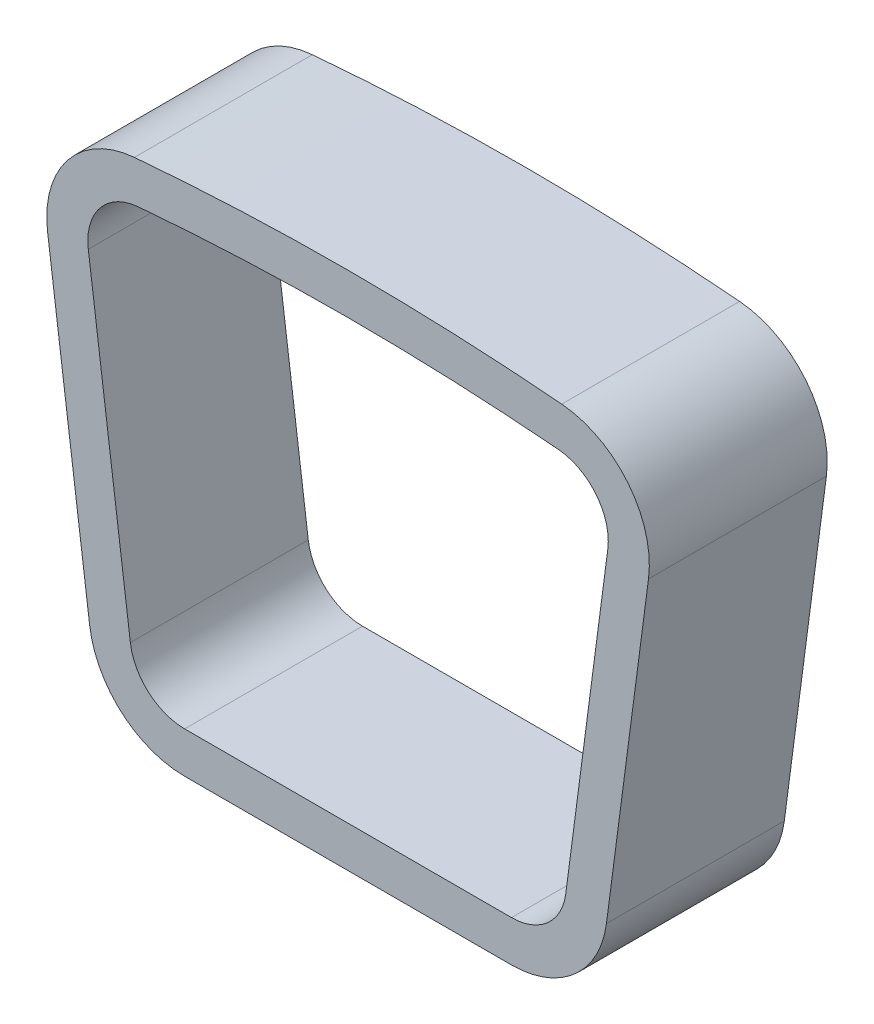
from build123d import *

# Parameters (mm, degrees)
BOSS_EXTRUDE1_DEPTH = 6.5


with BuildPart() as part:
    # Sketch1 → Boss-Extrude1 (new body)
    with BuildSketch(Plane.XY):
        with BuildLine():
            Line((9.441130989, 75.543158327), (10.978710332, 87.222232942))
            ThreePointArc((10.978710332, 87.222232942), (10.23623569, 89.872312951), (7.807292937, 91.166310537))
            ThreePointArc((7.807292937, 91.166310537), (0, 91.5), (-7.807292937, 91.166310537))
            ThreePointArc((-7.807292937, 91.166310537), (-10.23623569, 89.872312951), (-10.978710332, 87.222232942))
            Line((-10.978710332, 87.222232942), (-9.441130989, 75.543158327))
            ThreePointArc((-9.441130989, 75.543158327), (-8.278784327, 73.368560674), (-5.971073974, 72.5))
            Line((-5.971073974, 72.5), (5.971073974, 72.5))
            ThreePointArc((5.971073974, 72.5), (8.278784327, 73.368560674), (9.441130989, 75.543158327))
        make_face()
        with BuildLine():
            Line((-9.49154304, 87.418022231), (-7.953963697, 75.738947616))
            ThreePointArc((-7.953963697, 75.738947616), (-7.289765605, 74.496320385), (-5.971073974, 74))
            Line((-5.971073974, 74), (5.971073974, 74))
            ThreePointArc((5.971073974, 74), (7.289765605, 74.496320385), (7.953963697, 75.738947616))
            Line((7.953963697, 75.738947616), (9.49154304, 87.418022231))
            ThreePointArc((9.49154304, 87.418022231), (9.067271816, 88.932353664), (7.679304529, 89.671780856))
            ThreePointArc((7.679304529, 89.671780856), (0, 90), (-7.679304529, 89.671780856))
            ThreePointArc((-7.679304529, 89.671780856), (-9.067271816, 88.932353664), (-9.49154304, 87.418022231))
        make_face(mode=Mode.SUBTRACT)
    extrude(amount=BOSS_EXTRUDE1_DEPTH)


solid = part.part
